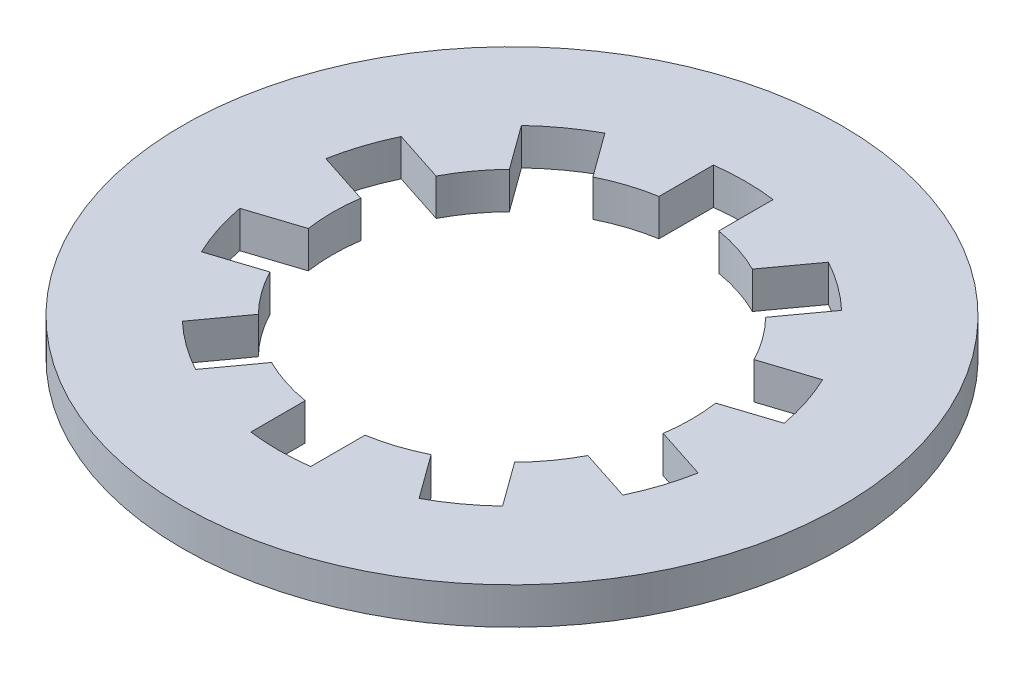
from build123d import *

# Parameters (mm, degrees)
SKETCH1_R          = 7.747
SKETCH1_R_2        = 4.2164
EXTRUDE1_DEPTH     = 0.8636
CUT_EXTRUDE1_DEPTH = 11.989896404
CIRPATTERN1_COUNT  = 10


with BuildPart() as part:
    # Sketch1 → Extrude1 (new body)
    with BuildSketch(Plane(origin=(0, 0, 0), x_dir=(1, 0, 0), z_dir=(0, 1, 0))):
        Circle(SKETCH1_R)
        Circle(SKETCH1_R_2, mode=Mode.SUBTRACT)
    extrude(amount=EXTRUDE1_DEPTH)

    # Sketch2 → Cut-Extrude1 (cut, through all)
    with BuildSketch(Plane(origin=(0, 0.8636, 0), x_dir=(-1, 0, 0), z_dir=(0, 1, 0))):
        with BuildLine():
            Line((-0.702733333, 5.43608635), (-0.702733333, 4.157426466))
            ThreePointArc((-0.702733333, 4.157426466), (0, 4.2164), (0.702733333, 4.157426466))
            Line((0.702733333, 4.157426466), (0.702733333, 5.43608635))
            ThreePointArc((0.702733333, 5.43608635), (0, 5.48132), (-0.702733333, 5.43608635))
        make_face()
    cut_extrude1 = extrude(amount=-CUT_EXTRUDE1_DEPTH, mode=Mode.SUBTRACT)

    # CirPattern1: Cut-Extrude1 ×10 about axis
    cirpattern1_axis = Axis((0, 7.230902229, 0), (0, -1, 0))
    for i in range(1, CIRPATTERN1_COUNT):
        add(cut_extrude1.rotate(cirpattern1_axis, i * 360 / CIRPATTERN1_COUNT), mode=Mode.SUBTRACT)


solid = part.part
